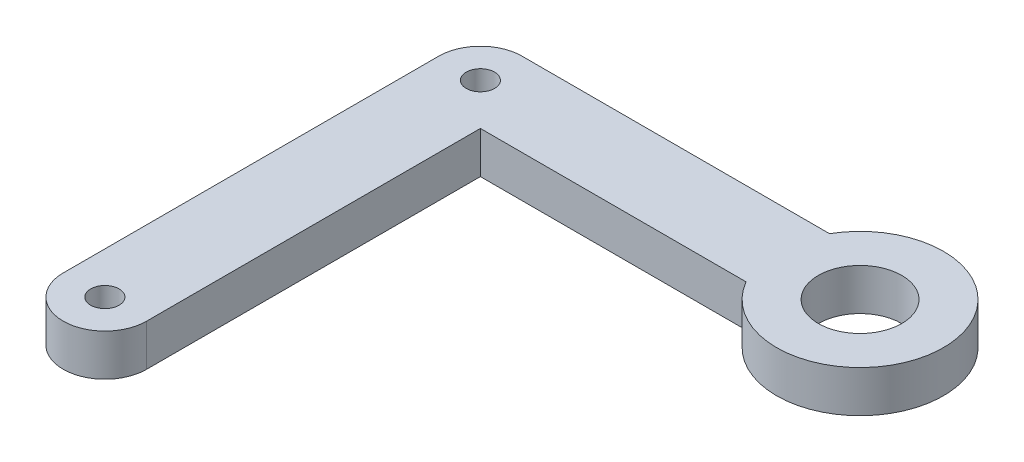
from build123d import *

# Parameters (mm, degrees)
SKETCH1_R           = 1.7
BOSS_EXTRUDE1_DEPTH = 5
SKETCH2_R           = 1.7
BOSS_EXTRUDE2_DEPTH = 5
SKETCH3_R           = 10
SKETCH3_R_2         = 5
BOSS_EXTRUDE3_DEPTH = 5
SKETCH4_R           = 5
CUT_EXTRUDE1_DEPTH  = 5


with BuildPart() as part:
    # Sketch1 → Boss-Extrude1 (new body)
    with BuildSketch(Plane(origin=(0, 0, 0), x_dir=(1, 0, 0), z_dir=(0, 1, 0))):
        with BuildLine():
            Line((-5, 0), (-5, 45))
            ThreePointArc((-5, 45), (0, 50), (5, 45))
            Line((5, 45), (5, 0))
            ThreePointArc((5, 0), (0, -5), (-5, 0))
        make_face()
        with Locations(Location((0, 0, 0), (0, 0, 270))):
            Circle(SKETCH1_R, mode=Mode.SUBTRACT)
        with Locations(Location((0, 45, 0), (0, 0, 270))):
            Circle(SKETCH1_R, mode=Mode.SUBTRACT)
    extrude(amount=BOSS_EXTRUDE1_DEPTH)

    # Sketch2 → Boss-Extrude2 (add)
    with BuildSketch(Plane.XZ):
        with BuildLine():
            Line((0, -40), (45.5, -40))
            ThreePointArc((45.5, -40), (50.5, -45), (45.5, -50))
            Line((45.5, -50), (0, -50))
            ThreePointArc((0, -50), (-5, -45), (0, -40))
        make_face()
        with Locations(Location((45.5, -45, 0), (0, 0, 270))):
            Circle(SKETCH2_R, mode=Mode.SUBTRACT)
        with Locations(Location((0, -45, 0), (0, 0, 90))):
            Circle(SKETCH2_R, mode=Mode.SUBTRACT)
    extrude(amount=-BOSS_EXTRUDE2_DEPTH)

    # Sketch3 → Boss-Extrude3 (add)
    with BuildSketch(Plane.XZ):
        with Locations((45.5, -45)):
            Circle(SKETCH3_R)
        with Locations((45.5, -45)):
            Circle(SKETCH3_R_2, mode=Mode.SUBTRACT)
    extrude(amount=-BOSS_EXTRUDE3_DEPTH)

    # Sketch4 → Cut-Extrude1 (cut)
    with BuildSketch(Plane.XZ):
        with Locations(Location((45.5, -45, 0), (0, 0, 270))):
            Circle(SKETCH4_R)
    extrude(amount=-CUT_EXTRUDE1_DEPTH, mode=Mode.SUBTRACT)


solid = part.part
